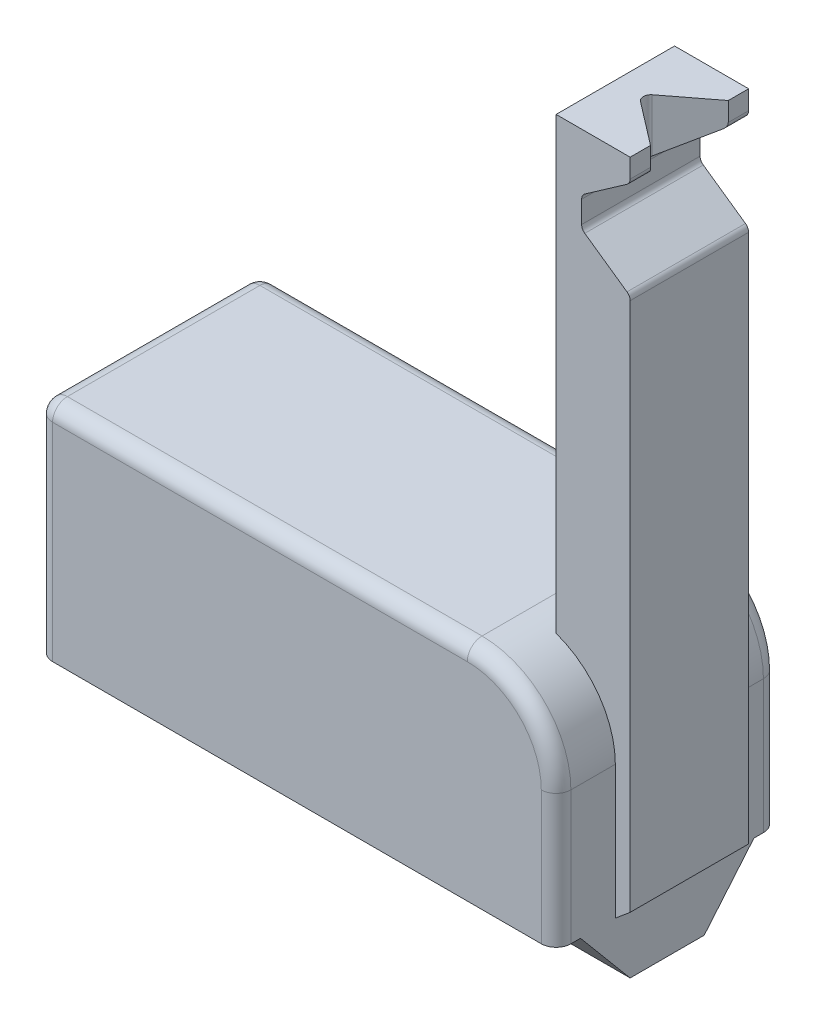
from build123d import *

# Parameters (mm, degrees)
BOSS_EXTRU_1_DEPTH      = 15
ESQUISSE2_W             = 5
ESQUISSE2_H             = 8
BOSS_EXTRU_2_DEPTH      = 45
ENL_V_MAT_EXTRU_1_DEPTH = 59.864250611
CONG_1_R                = 0.5
ENL_V_MAT_EXTRU_2_DEPTH = 5
BOSS_EXTRU_4_DEPTH      = 35
CONG_3_R                = 1
D_POUILLE2_ANGLE        = 40


with BuildPart() as part:
    # Esquisse1 → Boss.-Extru.1 (new body)
    with BuildSketch(Plane.XY):
        with BuildLine():
            Line((0, 0), (35, 0))
            Line((35, 0), (35, 9))
            ThreePointArc((35, 9), (33.242640687, 13.242640687), (29, 15))
            Line((29, 15), (0, 15))
            Line((0, 15), (0, 0))
        make_face()
    extrude(amount=BOSS_EXTRU_1_DEPTH)

    # Esquisse2 → Boss.-Extru.2 (add)
    with BuildSketch(Plane.XZ):
        with Locations((33.5, 7)):
            Rectangle(ESQUISSE2_W, ESQUISSE2_H)
    extrude(amount=-BOSS_EXTRU_2_DEPTH)

    # Esquisse3 → Enlèv. mat.-Extru.1 (cut, through all)
    with BuildSketch(Plane(origin=(0, 0, 3), x_dir=(-1, 0, 0), z_dir=(0, 0, -1))):
        Polygon((-36, 43.455794604), (-36, 36.867183113), (-32.723391823, 39.161488859), (-32.723391823, 41.161488859), align=None)
    extrude(amount=-ENL_V_MAT_EXTRU_1_DEPTH, mode=Mode.SUBTRACT)

    # Congé1
    cong_1_edges = [part.edges().sort_by_distance(p)[0] for p in [
        (36, 36.867183113, 7),
        (36, 43.455794604, 7),
        (32.723391823, 41.161488859, 7),
        (32.723391823, 39.161488859, 7),
    ]]
    fillet(cong_1_edges, radius=CONG_1_R)

    # Esquisse4 → Enlèv. mat.-Extru.2 (cut)
    with BuildSketch(Plane(origin=(0, 45, 0), x_dir=(1, 0, 0), z_dir=(0, 1, 0))):
        with BuildLine():
            Line((36, -4.374713624), (33.095619285, -6.60332333))
            ThreePointArc((33.095619285, -6.60332333), (32.9, -7), (33.095619285, -7.39667667))
            Line((33.095619285, -7.39667667), (36, -9.625286376))
            Line((36, -9.625286376), (36, -4.374713624))
        make_face()
    extrude(amount=-ENL_V_MAT_EXTRU_2_DEPTH, mode=Mode.SUBTRACT)

    # Esquisse6 → Boss.-Extru.4 (add)
    with BuildSketch(Plane.ZY):
        Polygon((13.356398525, 0), (1.643601475, 0), (5, -4), (10, -4), align=None)
    extrude(amount=-BOSS_EXTRU_4_DEPTH)

    # Congé3
    cong_3_edges = [part.edges().sort_by_distance(p)[0] for p in [
        (35, 4.5, 0),
        (33.242640687, 13.242640687, 0),
        (14.5, 15, 0),
        (35, 4.5, 15),
        (33.242640687, 13.242640687, 15),
        (14.5, 15, 15),
        (0, 15, 7.5),
        (0, 7.5, 15),
        (0, 7.5, 0),
    ]]
    fillet(cong_3_edges, radius=CONG_3_R)

    # Dépouille2
    d_pouille2_faces = [part.faces().sort_by_distance(p)[0] for p in [
        (35.5, 0, 7),
    ]]
    draft(d_pouille2_faces, Plane(origin=(35, 0, 15), x_dir=(0, 0, 1), z_dir=(1, 0, 0)), D_POUILLE2_ANGLE)


solid = part.part
